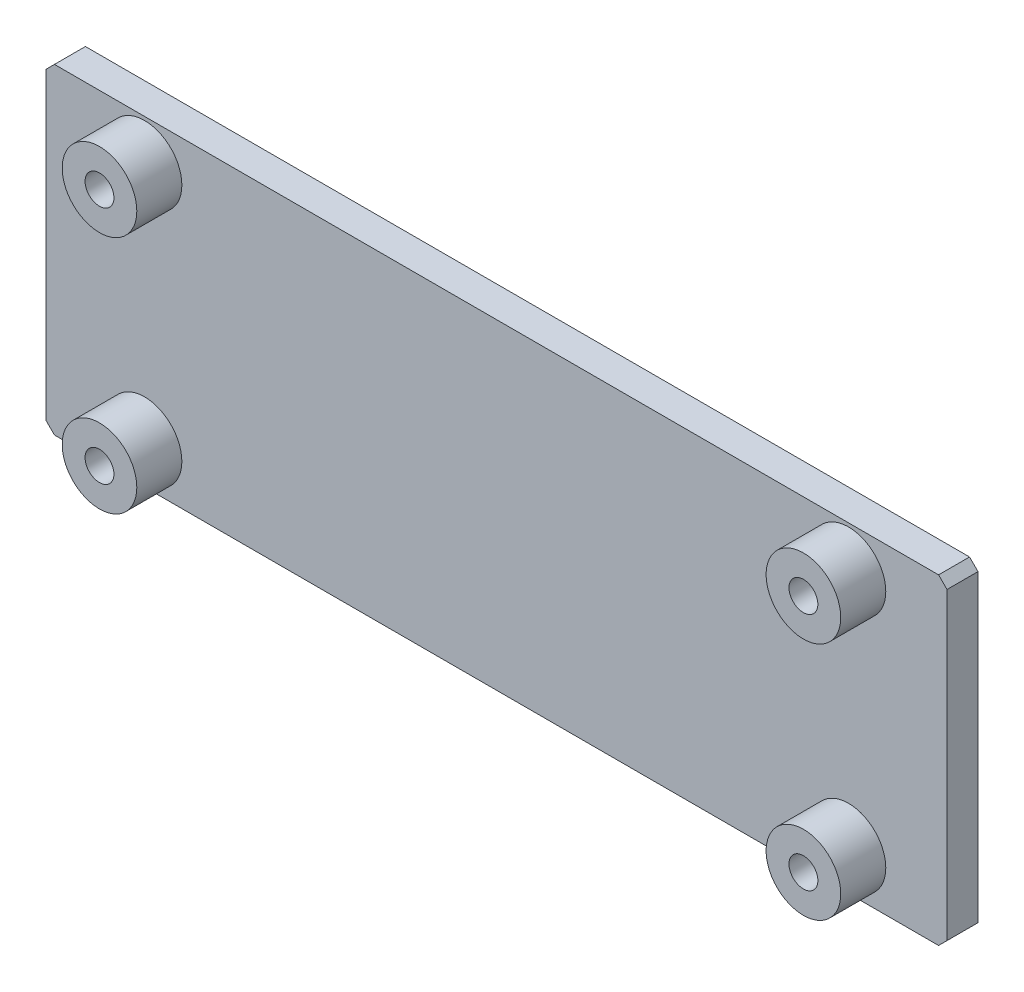
from build123d import *

# Parameters (mm, degrees)
FLAT_BACK_OF_SEPARATELY_PRINTED_SLIDE_IN_DEPTH = 1
PLATE_START                                    = 1
PLATE_RIM_WITH_BLIND_D2_05_PILOT_BOT_2_R       = 1.025
PLATE_RIM_WITH_BLIND_D2_05_PILOT_BOTTOMS_DEPTH = 1.2
RAISED_START                                   = 2.2
RAISED_POWER_BOARD_SUPPORTS_NO_NUT_2_R         = 2.65
RAISED_POWER_BOARD_SUPPORTS_NO_NUT_2_R_2       = 1.025
RAISED_POWER_BOARD_SUPPORTS_NO_NUTS_BE_DEPTH   = 3.2


with BuildPart() as part:
    # Flat back of separately printed slid 2 → Flat back of separately printed slide-in (new body)
    with BuildSketch(Plane.XY):
        Polygon((-31.4, -11.4), (31.4, -11.4), (32, -10.8), (32, 10.8), (31.4, 11.4), (-31.4, 11.4), (-32, 10.8), (-32, -10.8), align=None)
    extrude(amount=FLAT_BACK_OF_SEPARATELY_PRINTED_SLIDE_IN_DEPTH)

    # Plate rim with blind D2.05 pilot bot 2 → Plate rim with blind D2.05 pilot bottoms (add)
    with BuildSketch(Plane.XY.offset(PLATE_START)):
        Polygon((-31.4, -11.4), (31.4, -11.4), (32, -10.8), (32, 10.8), (31.4, 11.4), (-31.4, 11.4), (-32, 10.8), (-32, -10.8), align=None)
        with Locations((-25, -8.5)):
            Circle(PLATE_RIM_WITH_BLIND_D2_05_PILOT_BOT_2_R, mode=Mode.SUBTRACT)
        with Locations((-25, 8.5)):
            Circle(PLATE_RIM_WITH_BLIND_D2_05_PILOT_BOT_2_R, mode=Mode.SUBTRACT)
        with Locations((25, -8.5)):
            Circle(PLATE_RIM_WITH_BLIND_D2_05_PILOT_BOT_2_R, mode=Mode.SUBTRACT)
        with Locations((25, 8.5)):
            Circle(PLATE_RIM_WITH_BLIND_D2_05_PILOT_BOT_2_R, mode=Mode.SUBTRACT)
    extrude(amount=PLATE_RIM_WITH_BLIND_D2_05_PILOT_BOTTOMS_DEPTH)

    # Raised power board supports - no nut 2 → Raised power board supports - no nuts be (add)
    # profile 1 of 4: a face of its own
    with BuildSketch(Plane.XY.offset(RAISED_START)):
        with Locations((-25, -8.5)):
            Circle(RAISED_POWER_BOARD_SUPPORTS_NO_NUT_2_R)
        with Locations((-25, -8.5)):
            Circle(RAISED_POWER_BOARD_SUPPORTS_NO_NUT_2_R_2, mode=Mode.SUBTRACT)
    # profile 2 of 4: a face of its own
    with BuildSketch(Plane.XY.offset(RAISED_START)):
        with Locations((-25, 8.5)):
            Circle(RAISED_POWER_BOARD_SUPPORTS_NO_NUT_2_R)
        with Locations((-25, 8.5)):
            Circle(RAISED_POWER_BOARD_SUPPORTS_NO_NUT_2_R_2, mode=Mode.SUBTRACT)
    # profile 3 of 4: a face of its own
    with BuildSketch(Plane.XY.offset(RAISED_START)):
        with Locations((25, -8.5)):
            Circle(RAISED_POWER_BOARD_SUPPORTS_NO_NUT_2_R)
        with Locations((25, -8.5)):
            Circle(RAISED_POWER_BOARD_SUPPORTS_NO_NUT_2_R_2, mode=Mode.SUBTRACT)
    # profile 4 of 4: a face of its own
    with BuildSketch(Plane.XY.offset(RAISED_START)):
        with Locations((25, 8.5)):
            Circle(RAISED_POWER_BOARD_SUPPORTS_NO_NUT_2_R)
        with Locations((25, 8.5)):
            Circle(RAISED_POWER_BOARD_SUPPORTS_NO_NUT_2_R_2, mode=Mode.SUBTRACT)
    extrude(amount=RAISED_POWER_BOARD_SUPPORTS_NO_NUTS_BE_DEPTH)


solid = part.part
